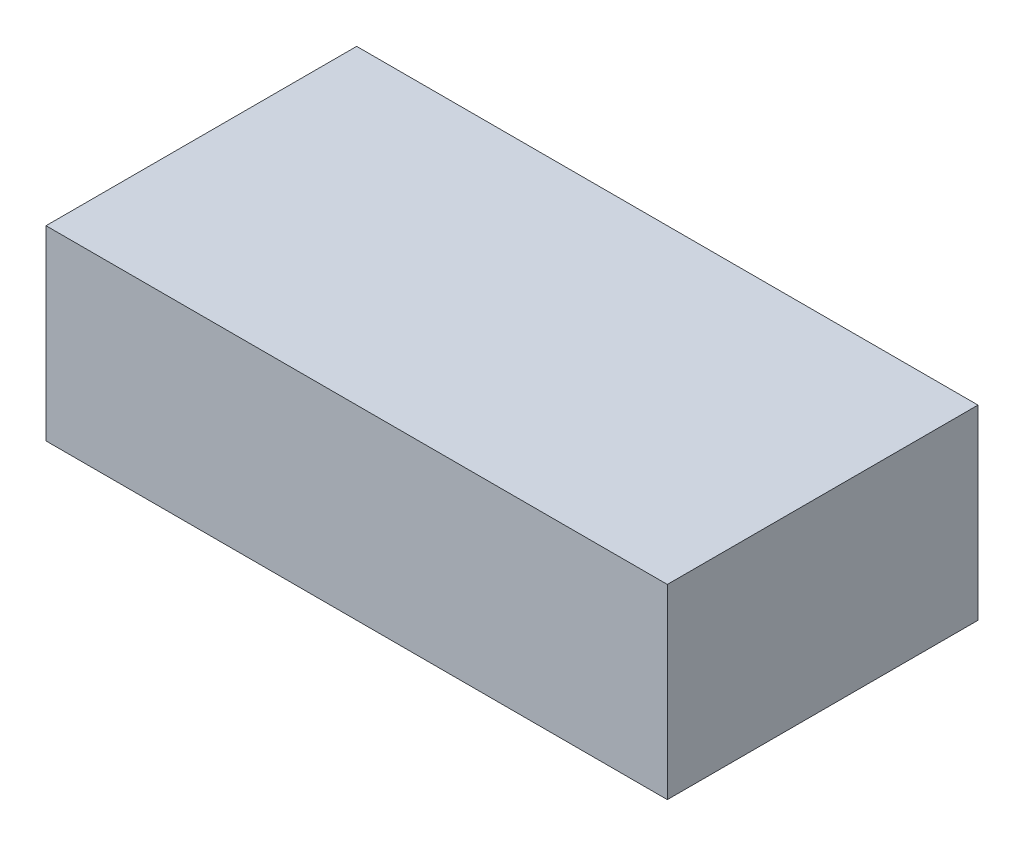
from build123d import *

# Parameters (mm, degrees)
SKETCH1_W           = 100
SKETCH1_H           = 50
BOSS_EXTRUDE1_DEPTH = 30


with BuildPart() as part:
    # Sketch1 → Boss-Extrude1 (new body)
    with BuildSketch(Plane(origin=(0, 0, 0), x_dir=(1, 0, 0), z_dir=(0, 1, 0))):
        Rectangle(SKETCH1_W, SKETCH1_H)
    extrude(amount=BOSS_EXTRUDE1_DEPTH)


solid = part.part
